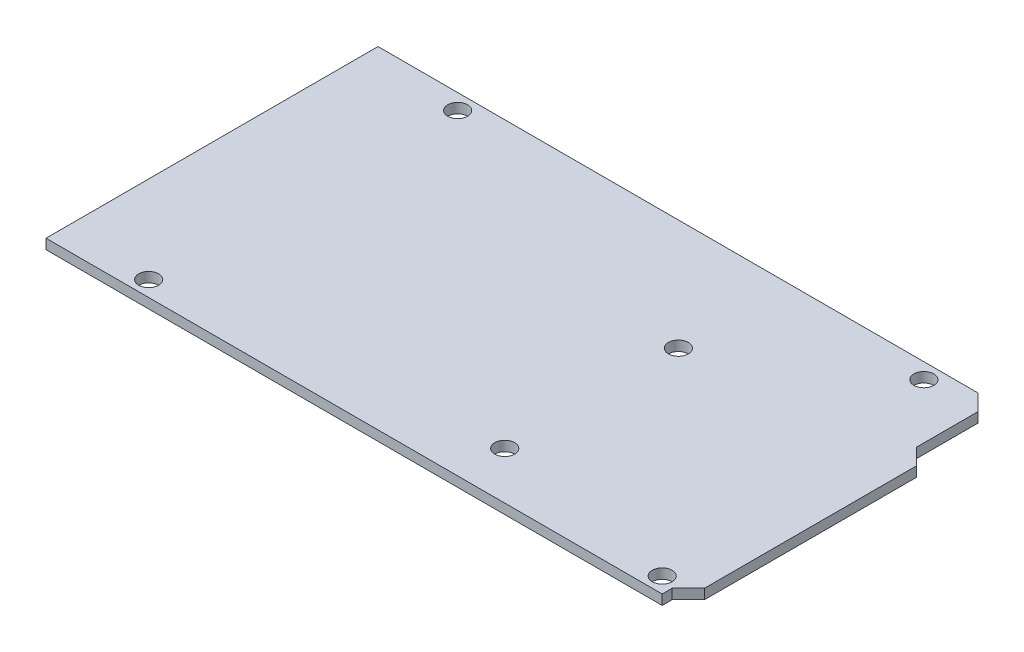
from build123d import *

# Parameters (mm, degrees)
BOSS_EXTRUDE1_DEPTH   = 1.6
ESBO_O1_R             = 1.6
CORTE_EXTRUS_O1_DEPTH = 10


with BuildPart() as part:
    # Sketch2 → Boss-Extrude1 (new body)
    with BuildSketch(Plane(origin=(0, 0, 0), x_dir=(1, 0, 0), z_dir=(0, 1, 0))):
        Polygon((50.8, -22.47), (50.8, 11.586871141), (48.2, 14.186871141), (48.2, 24.07), (45.6, 26.67), (-50.8, 26.67), (-50.8, -26.67), (48.2, -26.67), (48.2, -25.07), align=None)
    extrude(amount=BOSS_EXTRUDE1_DEPTH)

    # Esboço1 → Corte-extrusão1 (cut)
    with BuildSketch(Plane(origin=(0, 1.6, 0), x_dir=(1, 0, 0), z_dir=(0, 1, 0))):
        with Locations(Location((-35.5, 24.17, 0), (0, 0, 270))):
            Circle(ESBO_O1_R)
        with Locations(Location((-36.8, -24.17, 0), (0, 0, 270))):
            Circle(ESBO_O1_R)
        with Locations(Location((39.4, 24.17, 0), (0, 0, 270))):
            Circle(ESBO_O1_R)
        with Locations(Location((45.7, -24.17, 0), (0, 0, 270))):
            Circle(ESBO_O1_R)
        with Locations(Location((15.3, 8.83, 0), (0, 0, 270))):
            Circle(ESBO_O1_R)
        with Locations(Location((15.3, -19.07, 0), (0, 0, 270))):
            Circle(ESBO_O1_R)
    extrude(amount=-CORTE_EXTRUS_O1_DEPTH, mode=Mode.SUBTRACT)


solid = part.part
